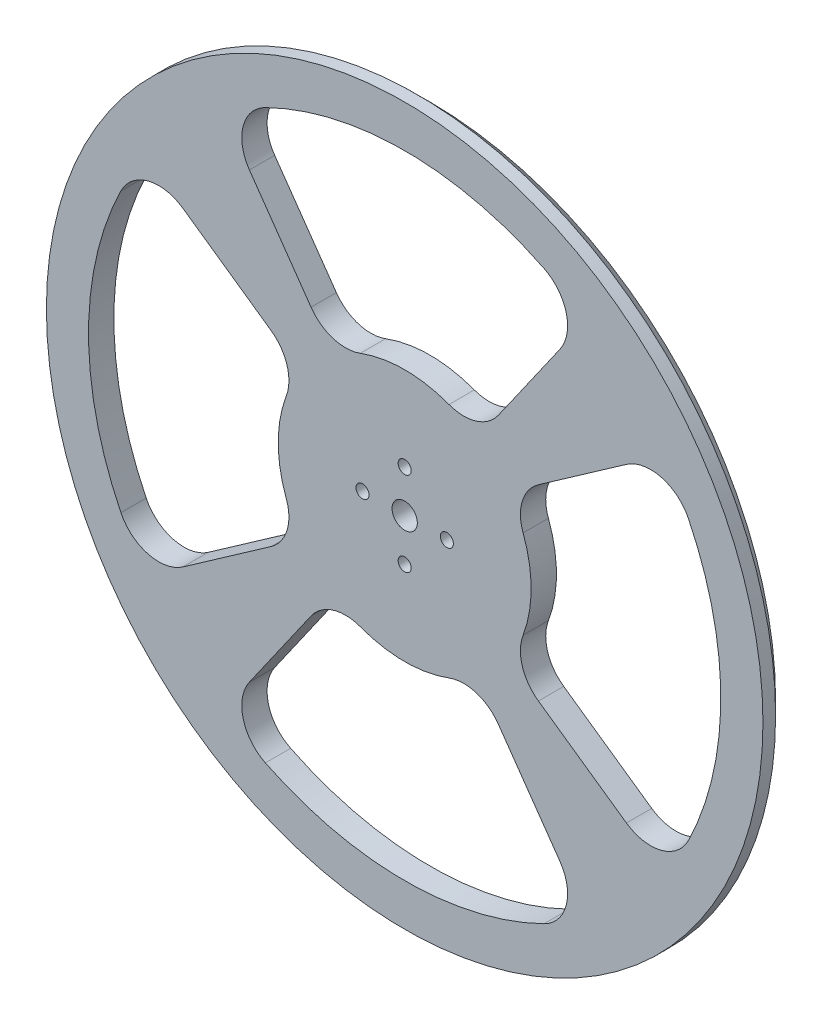
from build123d import *

# Parameters (mm, degrees)
SKETCH_1_R               = 85
SKETCH_1_R_2             = 3
EXTRUDE_1_DEPTH          = 6
SKETCH_2_R               = 1.55
CUT_EXTRUDE_1_DEPTH      = 121.357799913
PATTERN_CIRCULAR_2_COUNT = 4
CHAMFER_1_SIZE           = 3


with BuildPart() as part:
    # 草图1 → 凸台-拉伸1 (new body)
    with BuildSketch(Plane.XY):
        Circle(SKETCH_1_R)
        Circle(SKETCH_1_R_2, mode=Mode.SUBTRACT)
        with BuildLine():
            Line((-31.725622255, -22.214519858), (-52.610992631, -36.838613633))
            ThreePointArc((-52.610992631, -36.838613633), (-60.837871991, -38.331841306), (-67.323181147, -33.054338296))
            ThreePointArc((-67.323181147, -33.054338296), (-75, 0), (-67.323181147, 33.054338296))
            ThreePointArc((-67.323181147, 33.054338296), (-60.837871698, 38.331841382), (-52.610992136, 36.838613286))
            Line((-52.610992136, 36.838613286), (-31.725621944, 22.214519639))
            ThreePointArc((-31.725621944, 22.214519639), (-27.910605359, 16.986540764), (-28.096039964, 10.517249561))
            ThreePointArc((-28.096039964, 10.517249561), (-30, 0), (-28.096039964, -10.517249561))
            ThreePointArc((-28.096039964, -10.517249561), (-27.910605416, -16.986540946), (-31.725622255, -22.214519858))
        make_face(mode=Mode.SUBTRACT)
        with BuildLine():
            Line((22.214519858, -31.725622255), (36.838613633, -52.610992631))
            ThreePointArc((36.838613633, -52.610992631), (38.331841306, -60.837871991), (33.054338296, -67.323181147))
            ThreePointArc((33.054338296, -67.323181147), (0, -75), (-33.054338296, -67.323181147))
            ThreePointArc((-33.054338296, -67.323181147), (-38.331841382, -60.837871698), (-36.838613286, -52.610992136))
            Line((-36.838613286, -52.610992136), (-22.214519639, -31.725621944))
            ThreePointArc((-22.214519639, -31.725621944), (-16.986540764, -27.910605359), (-10.517249561, -28.096039964))
            ThreePointArc((-10.517249561, -28.096039964), (0, -30), (10.517249561, -28.096039964))
            ThreePointArc((10.517249561, -28.096039964), (16.986540946, -27.910605416), (22.214519858, -31.725622255))
        make_face(mode=Mode.SUBTRACT)
        with BuildLine():
            ThreePointArc((-10.517249561, 28.096039964), (-16.986540946, 27.910605416), (-22.214519858, 31.725622255))
            Line((-22.214519858, 31.725622255), (-36.838613633, 52.610992631))
            ThreePointArc((-36.838613633, 52.610992631), (-38.331841306, 60.837871991), (-33.054338296, 67.323181147))
            ThreePointArc((-33.054338296, 67.323181147), (0, 75), (33.054338296, 67.323181147))
            ThreePointArc((33.054338296, 67.323181147), (38.331841382, 60.837871698), (36.838613286, 52.610992136))
            Line((36.838613286, 52.610992136), (22.214519639, 31.725621944))
            ThreePointArc((22.214519639, 31.725621944), (16.986540764, 27.910605359), (10.517249561, 28.096039964))
            ThreePointArc((10.517249561, 28.096039964), (5.3440996, 29.520172755), (0, 30))
            ThreePointArc((0, 30), (-5.3440996, 29.520172755), (-10.517249561, 28.096039964))
        make_face(mode=Mode.SUBTRACT)
        with BuildLine():
            Line((31.725622255, 22.214519858), (52.610992631, 36.838613633))
            ThreePointArc((52.610992631, 36.838613633), (60.837871991, 38.331841306), (67.323181147, 33.054338296))
            ThreePointArc((67.323181147, 33.054338296), (75, 0), (67.323181147, -33.054338296))
            ThreePointArc((67.323181147, -33.054338296), (60.837871698, -38.331841382), (52.610992136, -36.838613286))
            Line((52.610992136, -36.838613286), (31.725621944, -22.214519639))
            ThreePointArc((31.725621944, -22.214519639), (27.910605359, -16.986540764), (28.096039964, -10.517249561))
            ThreePointArc((28.096039964, -10.517249561), (30, 0), (28.096039964, 10.517249561))
            ThreePointArc((28.096039964, 10.517249561), (27.910605416, 16.986540946), (31.725622255, 22.214519858))
        make_face(mode=Mode.SUBTRACT)
    extrude(amount=EXTRUDE_1_DEPTH)

    # 草图2 → 切除-拉伸1 (cut, through all)
    with BuildSketch(Plane.XY.offset(6)):
        with Locations((0, 10)):
            Circle(SKETCH_2_R)
    cut_extrude_1 = extrude(amount=-CUT_EXTRUDE_1_DEPTH, mode=Mode.SUBTRACT)

    # 阵列(圆周)2: 切除-拉伸1 ×4 about axis
    pattern_circular_2_axis = Axis((0, 0, 0), (0, 0, 1))
    for i in range(1, PATTERN_CIRCULAR_2_COUNT):
        add(cut_extrude_1.rotate(pattern_circular_2_axis, i * 360 / PATTERN_CIRCULAR_2_COUNT), mode=Mode.SUBTRACT)

    # 倒角1
    chamfer_1_edges = [part.edges().sort_by_distance(p)[0] for p in [
        (-85, 0, 0),
    ]]
    chamfer(chamfer_1_edges, length=CHAMFER_1_SIZE)


solid = part.part
